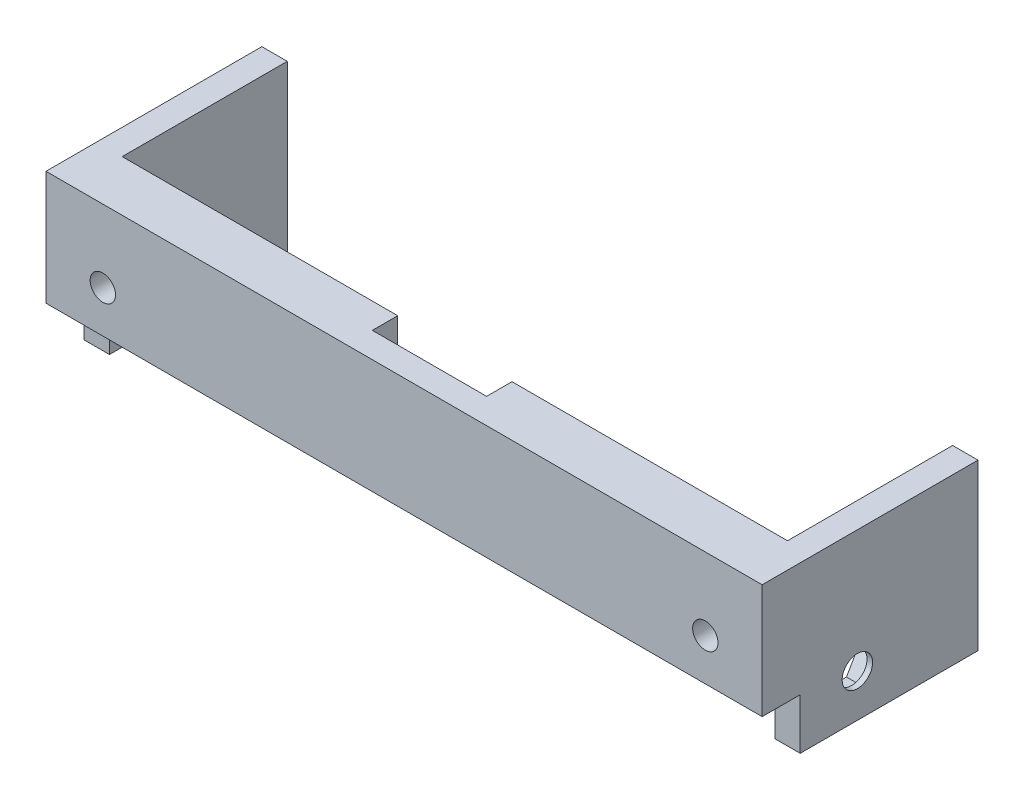
from build123d import *

# Parameters (mm, degrees)
SCHIZZO1_W                   = 56.4
SCHIZZO1_H                   = 9
SCHIZZO1_R                   = 1
ESTRUSIONE_ESTRUSIONE1_DEPTH = 3
SCHIZZO3_W                   = 14
SCHIZZO3_H                   = 13
ESTRUSIONE_ESTRUSIONE3_DEPTH = 2
FORO_PER_VITE_M2_1_D         = 2.4
FORO_PER_VITE_M2_1_DEPTH     = 56.4
TAGLIO_ESTRUSIONE1_DEPTH     = 1.56
SCHIZZO8_W                   = 9
SCHIZZO8_H                   = 1.5
TAGLIO_ESTRUSIONE2_DEPTH     = 1
SCHIZZO2_W                   = 52.4
SCHIZZO2_H                   = 2
ESTRUSIONE_ESTRUSIONE6_DEPTH = 1
SCHIZZO9_W                   = 9
SCHIZZO9_H                   = 2
TAGLIO_ESTRUSIONE3_DEPTH     = 2
TAGLIO_ESTRUSIONE5_START     = -29.09
SCHIZZO11_W                  = 13
SCHIZZO11_H                  = 0.6
TAGLIO_ESTRUSIONE5_DEPTH     = 74.965030919


with BuildPart() as part:
    # Schizzo1 → Estrusione-Estrusione1 (new body)
    with BuildSketch(Plane.XY):
        with Locations((0, -4.5)):
            Rectangle(SCHIZZO1_W, SCHIZZO1_H)
        with Locations((-23.725, -5.7)):
            Circle(SCHIZZO1_R, mode=Mode.SUBTRACT)
        with Locations(Location((23.725, -5.7, 0), (0, 0, 180))):
            Circle(SCHIZZO1_R, mode=Mode.SUBTRACT)
    extrude(amount=ESTRUSIONE_ESTRUSIONE1_DEPTH)

    # Schizzo3 → Estrusione-Estrusione3 (add)
    with BuildSketch(Plane(origin=(28.2, 0, 0), x_dir=(0, 0, -1), z_dir=(1, 0, 0))):
        with Locations((7, -6.5)):
            Rectangle(SCHIZZO3_W, SCHIZZO3_H)
    estrusione_estrusione3 = extrude(amount=-ESTRUSIONE_ESTRUSIONE3_DEPTH)

    # Foro per Vite M2-1
    with Locations(Plane(origin=(28.2, 0, 0), x_dir=(0, 0, -1), z_dir=(1, 0, 0))):
        with Locations((4.5, -9.64)):
            foro_per_vite_m2_1 = Hole(FORO_PER_VITE_M2_1_D / 2, depth=FORO_PER_VITE_M2_1_DEPTH)

    # Schizzo6 → Taglio-Estrusione1 (cut)
    with BuildSketch(Plane.ZY.offset(-26.2)):
        Polygon((-3.359733218, -7.665), (-5.640266782, -7.665), (-6.780533563, -9.64), (-5.640266782, -11.615), (-3.359733218, -11.615), (-2.219466437, -9.64), align=None)
    taglio_estrusione1 = extrude(amount=-TAGLIO_ESTRUSIONE1_DEPTH, mode=Mode.SUBTRACT)

    # Specchia2: Estrusione-Estrusione3, Foro per Vite M2-1, Taglio-Estrusione1 across plane
    add(estrusione_estrusione3.mirror(Plane(origin=(0, 0, 0), x_dir=(0, 0, 1), z_dir=(1, 0, 0))))
    add(foro_per_vite_m2_1.mirror(Plane(origin=(0, 0, 0), x_dir=(0, 0, 1), z_dir=(1, 0, 0))), mode=Mode.SUBTRACT)
    add(taglio_estrusione1.mirror(Plane(origin=(0, 0, 0), x_dir=(0, 0, 1), z_dir=(1, 0, 0))), mode=Mode.SUBTRACT)

    # Schizzo8 → Taglio-Estrusione2 (cut)
    with BuildSketch(Plane.XY):
        with Locations((9, -4.44)):
            Rectangle(SCHIZZO8_W, SCHIZZO8_H)
    extrude(amount=TAGLIO_ESTRUSIONE2_DEPTH, mode=Mode.SUBTRACT)

    # Schizzo2 → Estrusione-Estrusione6 (add)
    with BuildSketch(Plane(origin=(0, 0, 0), x_dir=(-1, 0, 0), z_dir=(0, 0, -1))):
        with Locations((0, -1)):
            Rectangle(SCHIZZO2_W, SCHIZZO2_H)
    extrude(amount=ESTRUSIONE_ESTRUSIONE6_DEPTH)

    # Schizzo9 → Taglio-Estrusione3 (cut)
    with BuildSketch(Plane(origin=(0, 0, 0), x_dir=(1, 0, 0), z_dir=(0, 1, 0))):
        Rectangle(SCHIZZO9_W, SCHIZZO9_H)
    extrude(amount=-TAGLIO_ESTRUSIONE3_DEPTH, mode=Mode.SUBTRACT)

    # Schizzo11 → Taglio-Estrusione5 (cut, through all)
    with BuildSketch(Plane(origin=(0, -32.78, -9), x_dir=(-1, 0, 0), z_dir=(0, -1, 0)).offset(TAGLIO_ESTRUSIONE5_START)):
        with Locations((15, -10.3)):
            Rectangle(SCHIZZO11_W, SCHIZZO11_H)
        with Locations((-15, -10.3)):
            Rectangle(SCHIZZO11_W, SCHIZZO11_H)
    extrude(amount=TAGLIO_ESTRUSIONE5_DEPTH, mode=Mode.SUBTRACT)


solid = part.part
